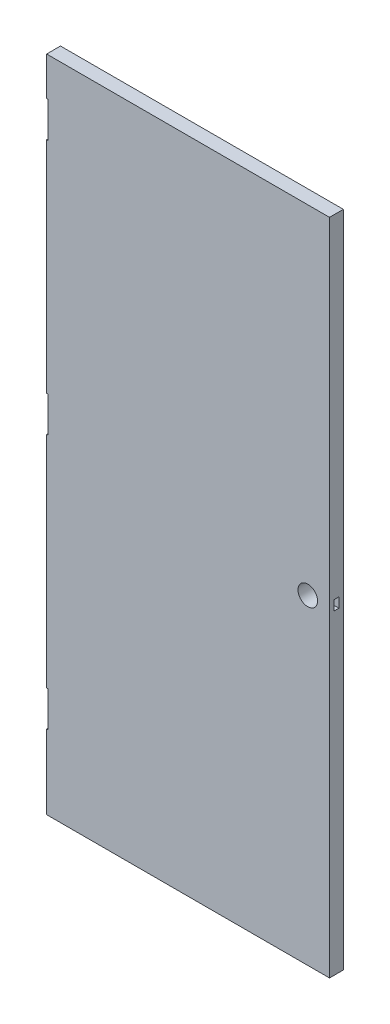
from build123d import *

# Parameters (mm, degrees)
BOSS_EXTRUDE1_DEPTH      = 22.225
BOSS_EXTRUDE1_DEPTH_BACK = 22.225
SKETCH3_R                = 31.4325
CUT_EXTRUDE1_REACH       = 1395.872
CUT_EXTRUDE1_END_RADIUS  = 31.4325
SKETCH4_W                = 15.71625
SKETCH4_H                = 31.4325


with BuildPart() as part:
    # Sketch3 → Boss-Extrude1 (new, two sides: drawn at the far end of the back side and taken through both)
    with BuildSketch(Plane.XY.offset(-BOSS_EXTRUDE1_DEPTH_BACK)):
        Polygon((454.025, -1057.275), (454.025, 1057.275), (-454.025, 1057.275), (-454.025, 933.45), (-449.453, 933.45), (-449.453, 819.15), (-454.025, 819.15), (-454.025, 114.3), (-449.453, 114.3), (-449.453, 0), (-454.025, 0), (-454.025, -704.85), (-449.453, -704.85), (-449.453, -819.15), (-454.025, -819.15), (-454.025, -1057.275), align=None)
        with Locations((384.175, -28.575)):
            Circle(SKETCH3_R, mode=Mode.SUBTRACT)
    extrude(amount=BOSS_EXTRUDE1_DEPTH + BOSS_EXTRUDE1_DEPTH_BACK)

    # Cut-Extrude1: up to this cylinder (the profile starts outside it)
    cut_extrude1_end = Plane(origin=(384.175, -28.575, 0), z_dir=(0, 0, 1)) * Cylinder(CUT_EXTRUDE1_END_RADIUS, 2855.609, mode=Mode.PRIVATE)
    # Sketch4 → Cut-Extrude1 (cut, up to the surface)
    with BuildSketch(Plane(origin=(454.025, 0, 0), x_dir=(0, 0, -1), z_dir=(1, 0, 0)), mode=Mode.PRIVATE) as cut_extrude1_sk1:
        with Locations((0, -28.575)):
            Rectangle(SKETCH4_W, SKETCH4_H)
    cut_extrude1_tool1 = extrude(cut_extrude1_sk1.sketch, amount=-CUT_EXTRUDE1_REACH, mode=Mode.PRIVATE) - cut_extrude1_end
    add(cut_extrude1_tool1.solids().sort_by_distance((454.025, -28.575, 0))[0], mode=Mode.SUBTRACT)


solid = part.part
